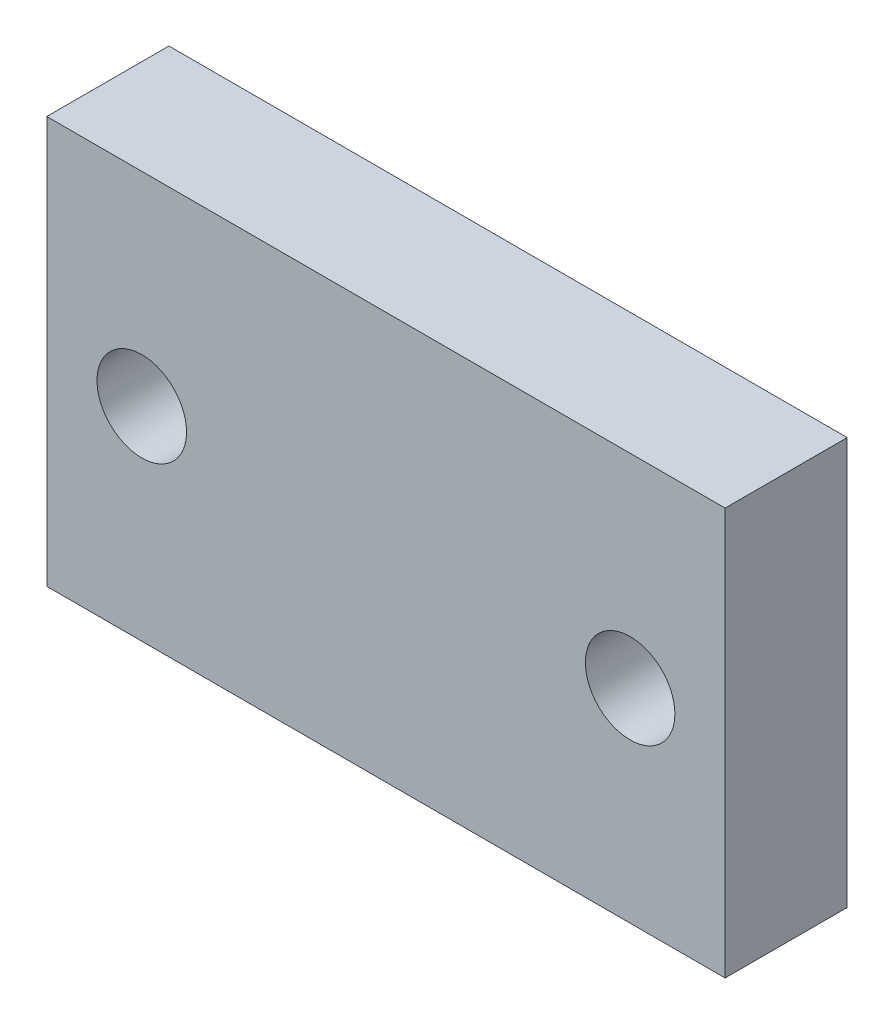
from build123d import *

# Parameters (mm, degrees)
SKETCH2_W            = 50
SKETCH2_H            = 30
BASE_DEPTH           = 9
M6_CLEARANCE_HOLE1_D = 6.6


with BuildPart() as part:
    # Sketch2 → base (new body)
    with BuildSketch(Plane.XY):
        with Locations((25, 15)):
            Rectangle(SKETCH2_W, SKETCH2_H)
    extrude(amount=BASE_DEPTH)

    # M6 Clearance Hole1 (through all)
    with Locations(Plane.XY.offset(9)):
        with Locations((7, 15), (43, 15)):
            Hole(M6_CLEARANCE_HOLE1_D / 2)


solid = part.part
